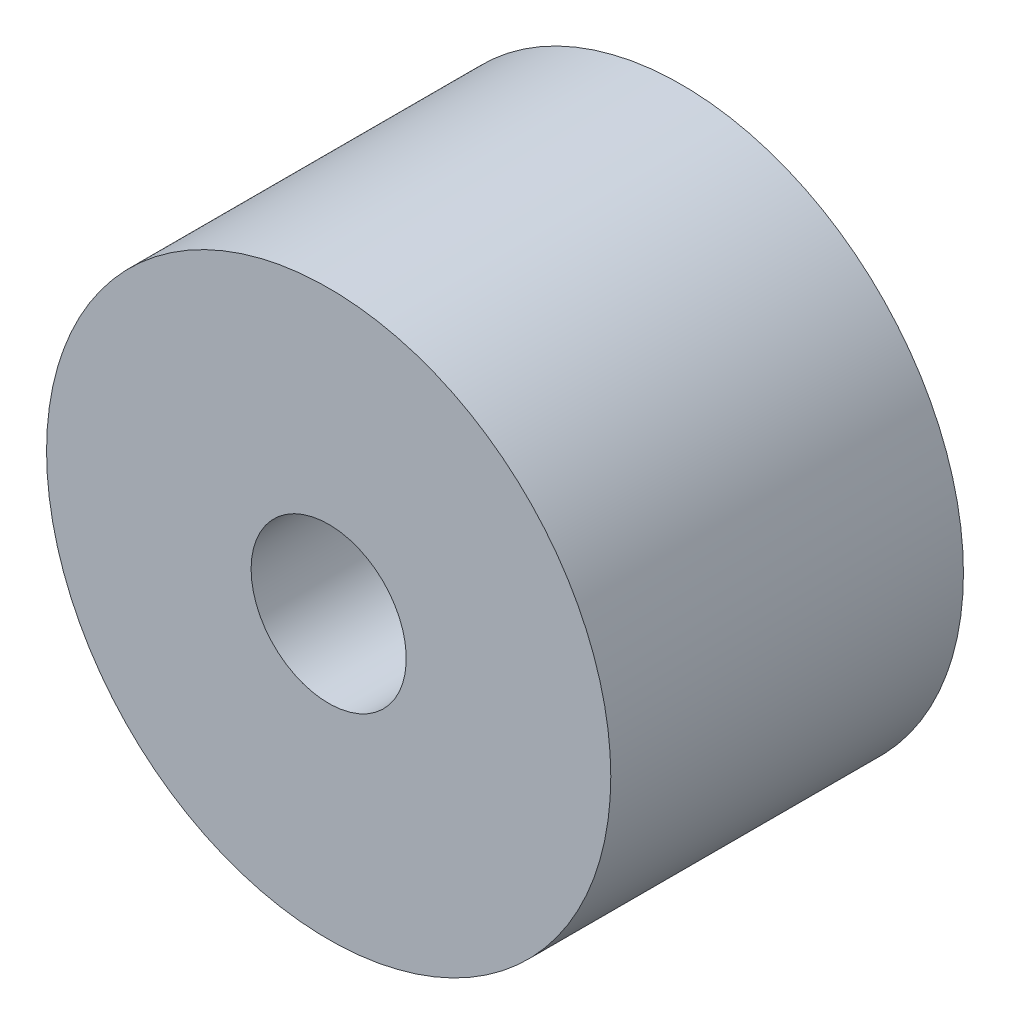
from build123d import *

# Parameters (mm, degrees)
SKETCH1_R           = 10.16
SKETCH1_R_2         = 2.794
BOSS_EXTRUDE3_DEPTH = 12.7


with BuildPart() as part:
    # Sketch1 → Boss-Extrude3 (new body)
    with BuildSketch(Plane.XY):
        with Locations(Location((0, 0, 0), (0, 0, 180))):
            Circle(SKETCH1_R)
        with Locations(Location((0, 0, 0), (0, 0, 180))):
            Circle(SKETCH1_R_2, mode=Mode.SUBTRACT)
    extrude(amount=BOSS_EXTRUDE3_DEPTH)


solid = part.part
